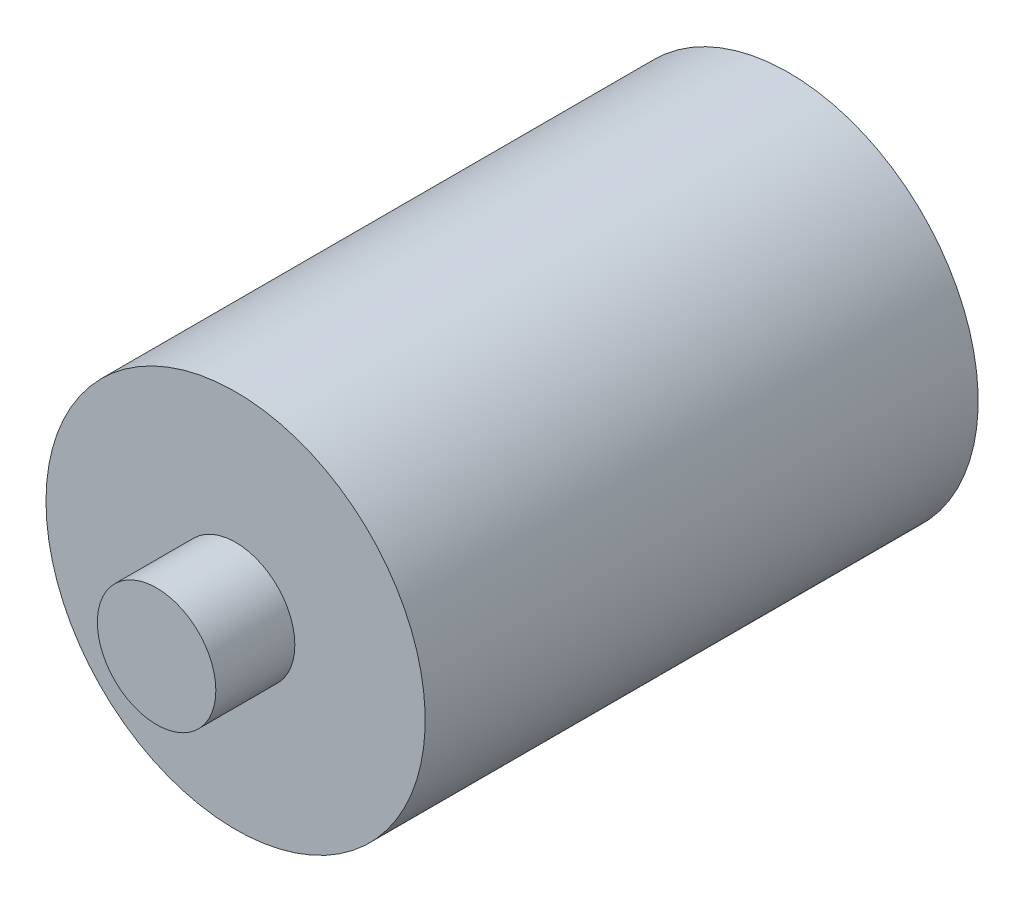
from build123d import *

# Parameters (mm, degrees)
SKETCH_1_R      = 15
EXTRUDE_1_DEPTH = 20
SKETCH_2_R      = 48
EXTRUDE_2_DEPTH = 140
EXTRUDE_START   = 20
SKETCH_3_R      = 15
EXTRUDE_3_DEPTH = 20


with BuildPart() as part:
    # 草图1 → 凸台-拉伸1 (new body)
    with BuildSketch(Plane.XY):
        Circle(SKETCH_1_R)
    extrude(amount=EXTRUDE_1_DEPTH)

    # 草图2 → 凸台-拉伸2 (add)
    with BuildSketch(Plane(origin=(0, 0, 0), x_dir=(-1, 0, 0), z_dir=(0, 0, -1))):
        Circle(SKETCH_2_R)
    extrude(amount=EXTRUDE_2_DEPTH)

    # 草图3 → 凸台-拉伸3 (add)
    with BuildSketch(Plane(origin=(0, 0, -140), x_dir=(-1, 0, 0), z_dir=(0, 0, -1)).offset(EXTRUDE_START)):
        with Locations(Location((0, 0, 0), (0, 0, 180))):
            Circle(SKETCH_3_R)
    extrude(amount=-EXTRUDE_3_DEPTH)


solid = part.part
